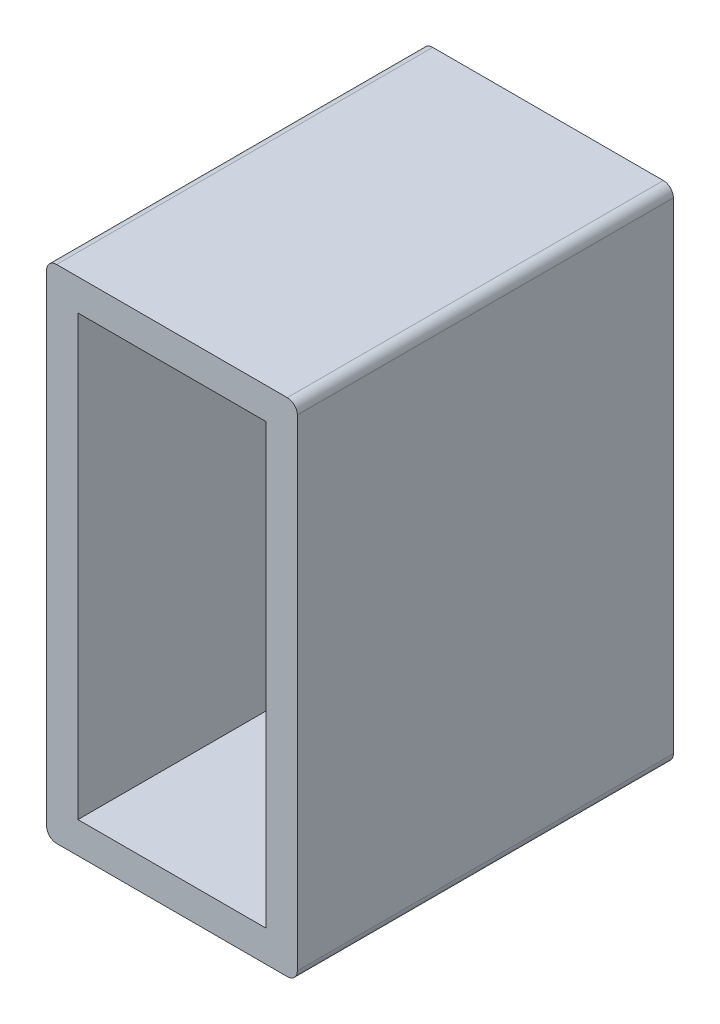
from build123d import *

# Parameters (mm, degrees)
SKETCH1_W           = 19.05
SKETCH1_H           = 44.45
BOSS_EXTRUDE1_DEPTH = 19.05


with BuildPart() as part:
    # Sketch1 → Boss-Extrude1 (new, symmetric)
    with BuildSketch(Plane.XY):
        with BuildLine():
            Line((-11.684, -25.4), (11.684, -25.4))
            ThreePointArc((11.684, -25.4), (12.40242049, -25.10242049), (12.7, -24.384))
            Line((12.7, -24.384), (12.7, 24.384))
            ThreePointArc((12.7, 24.384), (12.40242049, 25.10242049), (11.684, 25.4))
            Line((11.684, 25.4), (-11.684, 25.4))
            ThreePointArc((-11.684, 25.4), (-12.40242049, 25.10242049), (-12.7, 24.384))
            Line((-12.7, 24.384), (-12.7, -24.384))
            ThreePointArc((-12.7, -24.384), (-12.40242049, -25.10242049), (-11.684, -25.4))
        make_face()
        Rectangle(SKETCH1_W, SKETCH1_H, mode=Mode.SUBTRACT)
    extrude(amount=BOSS_EXTRUDE1_DEPTH, both=True)


solid = part.part
